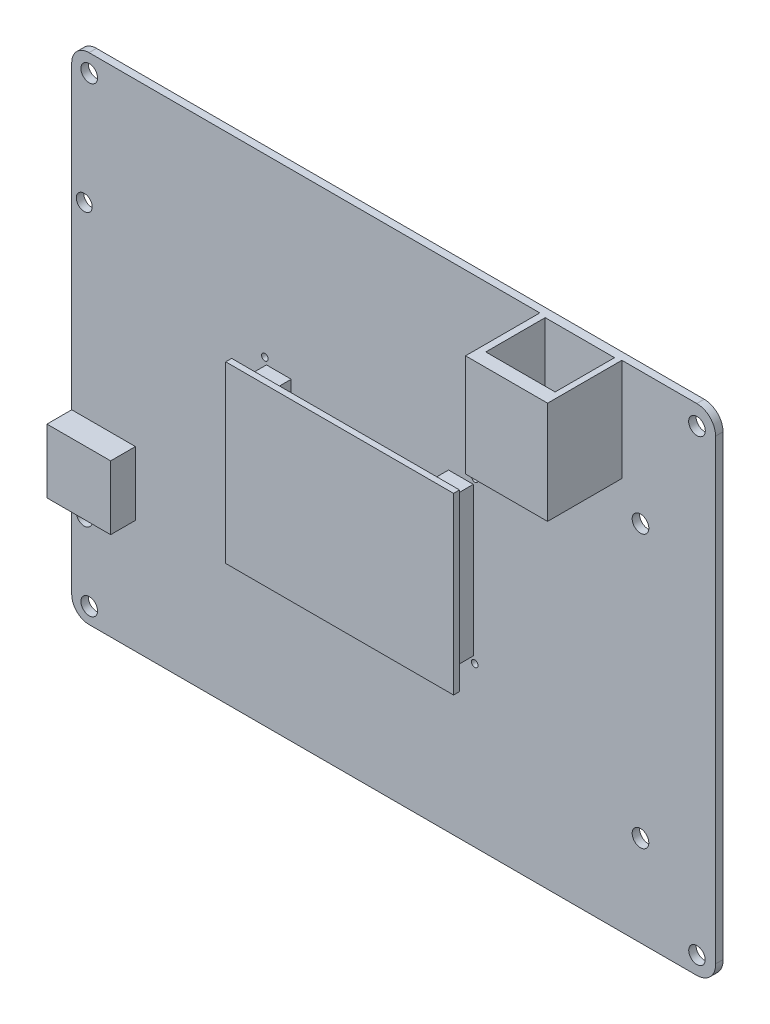
from build123d import *

# Parameters (mm, degrees)
SKETCH_1_R          = 1.680805835
SKETCH_1_R_2        = 0.406348663
SKETCH_1_R_3        = 0.591052601
SKETCH_1_R_4        = 0.609522995
SKETCH_1_R_5        = 0.664934176
SKETCH_1_R_6        = 1.662335441
SKETCH_1_R_7        = 1.6
EXTRUDE_2_DEPTH     = 1.5
SKETCH_2_W          = 5
SKETCH_2_H          = 30
EXTRUDE_3_DEPTH     = 5
SKETCH_3_W          = 46
SKETCH_3_H          = 35.259040571
EXTRUDE_4_DEPTH     = 1.2
SKETCH_4_W          = 16.562645757
SKETCH_4_H          = 20.676210758
EXTRUDE_5_DEPTH     = 15
SKETCH_5_W          = 14
SKETCH_5_H          = 12
CUT_EXTRUDE_1_DEPTH = 16
SKETCH_6_W          = 12.857554965
SKETCH_6_H          = 12.912362425
EXTRUDE_6_DEPTH     = 5
SKETCH_9_W          = 3.8
SKETCH_9_H          = 10.912362425
CUT_EXTRUDE_2_DEPTH = 11


with BuildPart() as part:
    # 草图1 → 凸台-拉伸2 (new body)
    with BuildSketch(Plane.XY):
        with BuildLine():
            Line((42.436427683, 56.053220537), (165.136427683, 56.053220537))
            ThreePointArc((165.136427683, 56.053220537), (167.867822265, 57.210483747), (168.936427683, 59.977767064))
            Line((168.936427683, 59.977767064), (168.936427683, 152.253220537))
            ThreePointArc((168.936427683, 152.253220537), (167.823433451, 154.940226305), (165.136427683, 156.053220537))
            Line((165.136427683, 156.053220537), (42.436427683, 156.053220537))
            ThreePointArc((42.436427683, 156.053220537), (39.961553949, 155.028094271), (38.936427683, 152.553220537))
            Line((38.936427683, 152.553220537), (38.936427683, 59.553220537))
            ThreePointArc((38.936427683, 59.553220537), (39.961553949, 57.078346802), (42.436427683, 56.053220537))
        make_face()
        with Locations((153.770781099, 129.383220537)):
            Circle(SKETCH_1_R, mode=Mode.SUBTRACT)
        with Locations((117.383571785, 118.473779489)):
            Circle(SKETCH_1_R_2, mode=Mode.SUBTRACT)
        with Locations((80.77524922, 90.287954645)):
            Circle(SKETCH_1_R_3, mode=Mode.SUBTRACT)
        with Locations((117.36509862, 90.269480326)):
            Circle(SKETCH_1_R_4, mode=Mode.SUBTRACT)
        with Locations((80.775251991, 118.436830852)):
            Circle(SKETCH_1_R_2, mode=Mode.SUBTRACT)
        with Locations((77.930808577, 120.563856588)):
            Circle(SKETCH_1_R_5, mode=Mode.SUBTRACT)
        with Locations((120.330808475, 120.56092691)):
            Circle(SKETCH_1_R_5, mode=Mode.SUBTRACT)
        with Locations((120.301889386, 88.163856588)):
            Circle(SKETCH_1_R_5, mode=Mode.SUBTRACT)
        with Locations((77.930808577, 88.163856588)):
            Circle(SKETCH_1_R_5, mode=Mode.SUBTRACT)
        with Locations((165.170781099, 59.633220537)):
            Circle(SKETCH_1_R_6, mode=Mode.SUBTRACT)
        with Locations((165.170781099, 152.133220537)):
            Circle(SKETCH_1_R, mode=Mode.SUBTRACT)
        with Locations((42.470781099, 152.483220537)):
            Circle(SKETCH_1_R, mode=Mode.SUBTRACT)
        with Locations((42.470781099, 59.283220537)):
            Circle(SKETCH_1_R, mode=Mode.SUBTRACT)
        with Locations(Location((153.770781099, 74.383220537, 0), (0, 0, 180))):
            Circle(SKETCH_1_R, mode=Mode.SUBTRACT)
        with Locations(Location((41.470781099, 74.383220537, 0), (0, 0, 180))):
            Circle(SKETCH_1_R_7, mode=Mode.SUBTRACT)
        with Locations((41.470781099, 129.383220537)):
            Circle(SKETCH_1_R_7, mode=Mode.SUBTRACT)
    extrude(amount=EXTRUDE_2_DEPTH)

    # 草图2 → 凸台-拉伸3 (add)
    with BuildSketch(Plane.XY.offset(1.5)):
        with Locations((80.750808475, 104.36092691)):
            Rectangle(SKETCH_2_W, SKETCH_2_H)
        with Locations((117.510808475, 104.36092691)):
            Rectangle(SKETCH_2_W, SKETCH_2_H)
    extrude(amount=EXTRUDE_3_DEPTH)

    # 草图3 → 凸台-拉伸4 (add)
    with BuildSketch(Plane.XY.offset(6.5)):
        with Locations((99.230808475, 104.360926909)):
            Rectangle(SKETCH_3_W, SKETCH_3_H)
    extrude(amount=EXTRUDE_4_DEPTH)

    # 草图4 → 凸台-拉伸5 (add)
    with BuildSketch(Plane.XY.offset(1.5)):
        with Locations((141.730083201, 145.715115158)):
            Rectangle(SKETCH_4_W, SKETCH_4_H)
    extrude(amount=EXTRUDE_5_DEPTH)

    # 草图5 → 切除-拉伸1 (cut)
    with BuildSketch(Plane(origin=(0, 156.053220537, 0), x_dir=(1, 0, 0), z_dir=(0, 1, 0))):
        with Locations((141.815149852, -7.784103515)):
            Rectangle(SKETCH_5_W, SKETCH_5_H)
    extrude(amount=-CUT_EXTRUDE_1_DEPTH, mode=Mode.SUBTRACT)

    # 草图6 → 凸台-拉伸6 (add)
    with BuildSketch(Plane.XY.offset(1.5)):
        with Locations((45.365205166, 85.403032826)):
            Rectangle(SKETCH_6_W, SKETCH_6_H)
    extrude(amount=EXTRUDE_6_DEPTH)

    # 草图9 → 切除-拉伸2 (cut)
    with BuildSketch(Plane.ZY.offset(-38.936427683)):
        with Locations((3.4, 85.403032826)):
            Rectangle(SKETCH_9_W, SKETCH_9_H)
    extrude(amount=-CUT_EXTRUDE_2_DEPTH, mode=Mode.SUBTRACT)


solid = part.part
